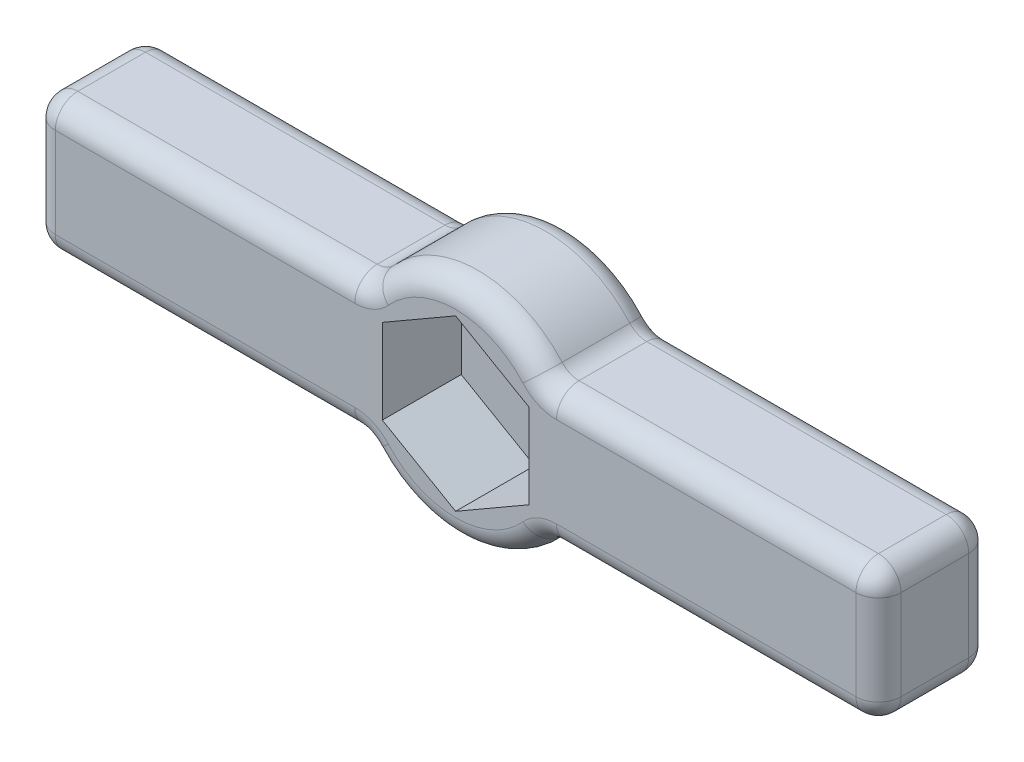
from build123d import *

# Parameters (mm, degrees)
SKETCH1_W           = 75
SKETCH1_H           = 12
BOSS_EXTRUDE1_DEPTH = 10
CUT_EXTRUDE1_DEPTH  = 7
SKETCH3_R           = 10
BOSS_EXTRUDE2_DEPTH = 10
BOSS_EXTRUDE3_DEPTH = 3
FILLET1_R           = 2


with BuildPart() as part:
    # Sketch1 → Boss-Extrude1 (new body)
    with BuildSketch(Plane.XY):
        Rectangle(SKETCH1_W, SKETCH1_H)
    extrude(amount=BOSS_EXTRUDE1_DEPTH)

    # Sketch2 → Cut-Extrude1 (cut)
    with BuildSketch(Plane.XY.offset(10)):
        Polygon((0, -7.505553499), (6.5, -3.75277675), (6.5, 3.75277675), (0, 7.505553499), (-6.5, 3.75277675), (-6.5, -3.75277675), align=None)
    extrude(amount=-CUT_EXTRUDE1_DEPTH, mode=Mode.SUBTRACT)

    # Sketch3 → Boss-Extrude2 (add)
    with BuildSketch(Plane(origin=(0, 0, 0), x_dir=(-1, 0, 0), z_dir=(0, 0, -1))):
        Circle(SKETCH3_R)
        Polygon((0, -7.505553499), (6.5, -3.75277675), (6.5, 3.75277675), (0, 7.505553499), (-6.5, 3.75277675), (-6.5, -3.75277675), align=None, mode=Mode.SUBTRACT)
    extrude(amount=-BOSS_EXTRUDE2_DEPTH)

    # Sketch4 → Boss-Extrude3 (add)
    with BuildSketch(Plane(origin=(0, 0, 0), x_dir=(-1, 0, 0), z_dir=(0, 0, -1))):
        Polygon((2.607695155, 6), (0, 7.505553499), (-2.607695155, 6), align=None)
        Polygon((0, -7.505553499), (2.607695155, -6), (-2.607695155, -6), align=None)
    extrude(amount=-BOSS_EXTRUDE3_DEPTH)

    # Fillet1
    fillet1_edges = [part.edges().sort_by_distance(p)[0] for p in [
        (-37.5, 0, 10),
        (-22.75, -6, 10),
        (37.5, 0, 10),
        (-22.75, -6, 0),
        (22.75, -6, 0),
        (-22.75, 6, 0),
        (-37.5, 0, 0),
        (22.75, -6, 10),
        (22.75, 6, 0),
        (-22.75, 6, 10),
        (0, 10, 0),
        (0, -10, 0),
        (0, 10, 10),
        (37.5, 0, 0),
        (-8, 6, 5),
        (-8, -6, 5),
        (0, -10, 10),
        (8, 6, 5),
        (8, -6, 5),
        (22.75, 6, 10),
        (37.5, -6, 5),
        (-37.5, -6, 5),
        (-37.5, 6, 5),
        (37.5, 6, 5),
    ]]
    fillet(fillet1_edges, radius=FILLET1_R)


solid = part.part
